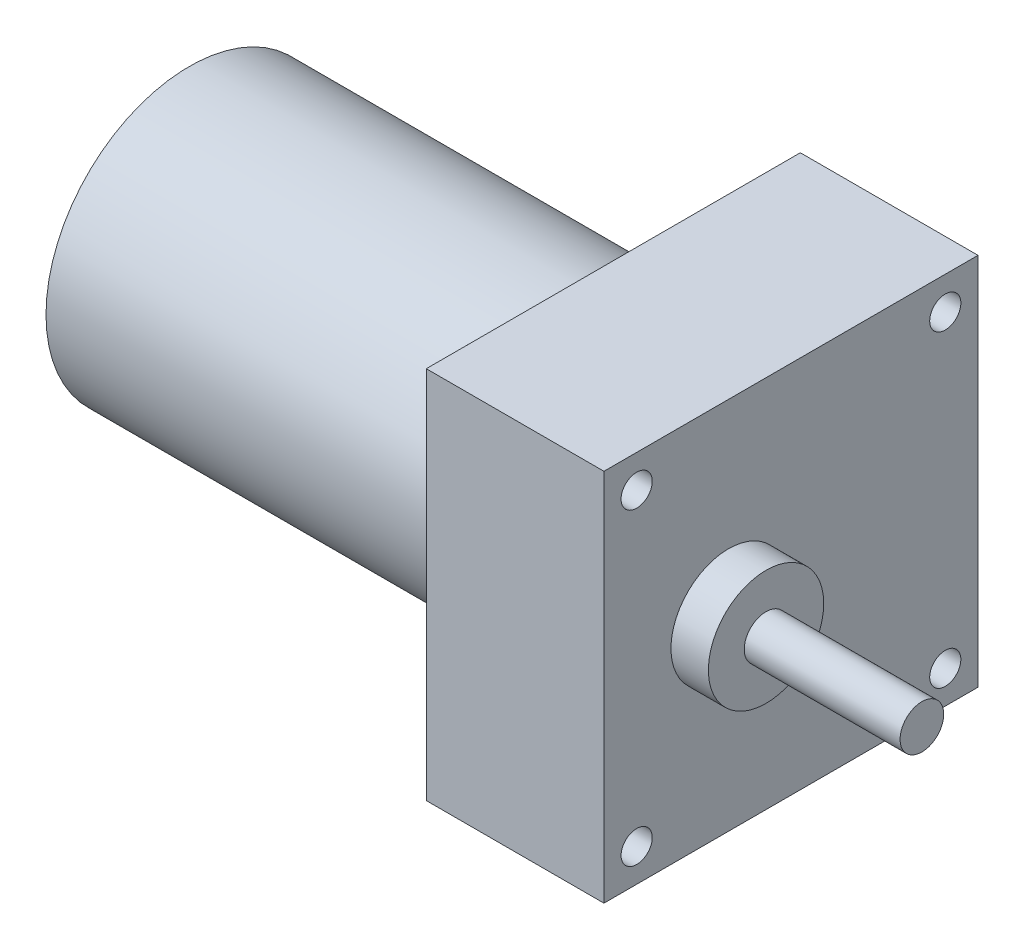
from build123d import *

# Parameters (mm, degrees)
SKETCH1_W           = 60
SKETCH1_H           = 60
SKETCH1_R           = 2.5
SKETCH1_R_2         = 9.25
SKETCH1_R_3         = 3.5
BOSS_EXTRUDE1_DEPTH = 28.5
BOSS_EXTRUDE2_START = 28.5
SKETCH1_3_R         = 9.25
SKETCH1_3_R_2       = 3.5
BOSS_EXTRUDE2_DEPTH = 6
BOSS_EXTRUDE3_START = 34.5
SKETCH1_4_R         = 3.5
BOSS_EXTRUDE3_DEPTH = 25
SKETCH2_R           = 23
BOSS_EXTRUDE4_DEPTH = 68


with BuildPart() as part:
    # Sketch1 → Boss-Extrude1 (new body)
    # profile 1 of 3: a face of its own
    with BuildSketch(Plane.YZ):
        Rectangle(SKETCH1_W, SKETCH1_H)
        with Locations(Location((24.75, 24.75, 0), (0, 0, 90))):
            Circle(SKETCH1_R, mode=Mode.SUBTRACT)
        with Locations(Location((-24.75, 24.75, 0), (0, 0, 90))):
            Circle(SKETCH1_R, mode=Mode.SUBTRACT)
        with Locations(Location((24.75, -24.75, 0), (0, 0, 90))):
            Circle(SKETCH1_R, mode=Mode.SUBTRACT)
        with Locations(Location((-24.75, -24.75, 0), (0, 0, 90))):
            Circle(SKETCH1_R, mode=Mode.SUBTRACT)
    # profile 2 of 3: a face of its own
    with BuildSketch(Plane.YZ):
        with Locations((0, 10)):
            Circle(SKETCH1_R_2)
        with Locations((0, 10)):
            Circle(SKETCH1_R_3, mode=Mode.SUBTRACT)
    # profile 3 of 3: a face of its own
    with BuildSketch(Plane.YZ):
        with Locations((0, 10)):
            Circle(SKETCH1_R_3)
    extrude(amount=BOSS_EXTRUDE1_DEPTH)

    # Sketch1<3> → Boss-Extrude2 (add)
    with BuildSketch(Plane.YZ.offset(BOSS_EXTRUDE2_START)):
        with Locations(Location((0, 10, 0), (0, 0, 270))):
            Circle(SKETCH1_3_R)
        with Locations(Location((0, 10, 0), (0, 0, 270))):
            Circle(SKETCH1_3_R_2, mode=Mode.SUBTRACT)
    extrude(amount=BOSS_EXTRUDE2_DEPTH)

    # Sketch2 → Boss-Extrude4 (add)
    with BuildSketch(Plane(origin=(0, 0, 0), x_dir=(0, -1, 0), z_dir=(-1, 0, 0))):
        with Locations(Location((0, 0, 0), (0, 0, 270))):
            Circle(SKETCH2_R)
    extrude(amount=BOSS_EXTRUDE4_DEPTH)


with BuildPart() as body_2:
    # Sketch1<4> → Boss-Extrude3 (new body)
    with BuildSketch(Plane.YZ.offset(BOSS_EXTRUDE3_START)):
        with Locations(Location((0, 10, 0), (0, 0, 270))):
            Circle(SKETCH1_4_R)
    extrude(amount=BOSS_EXTRUDE3_DEPTH)


solid = Compound([part.part, body_2.part])
